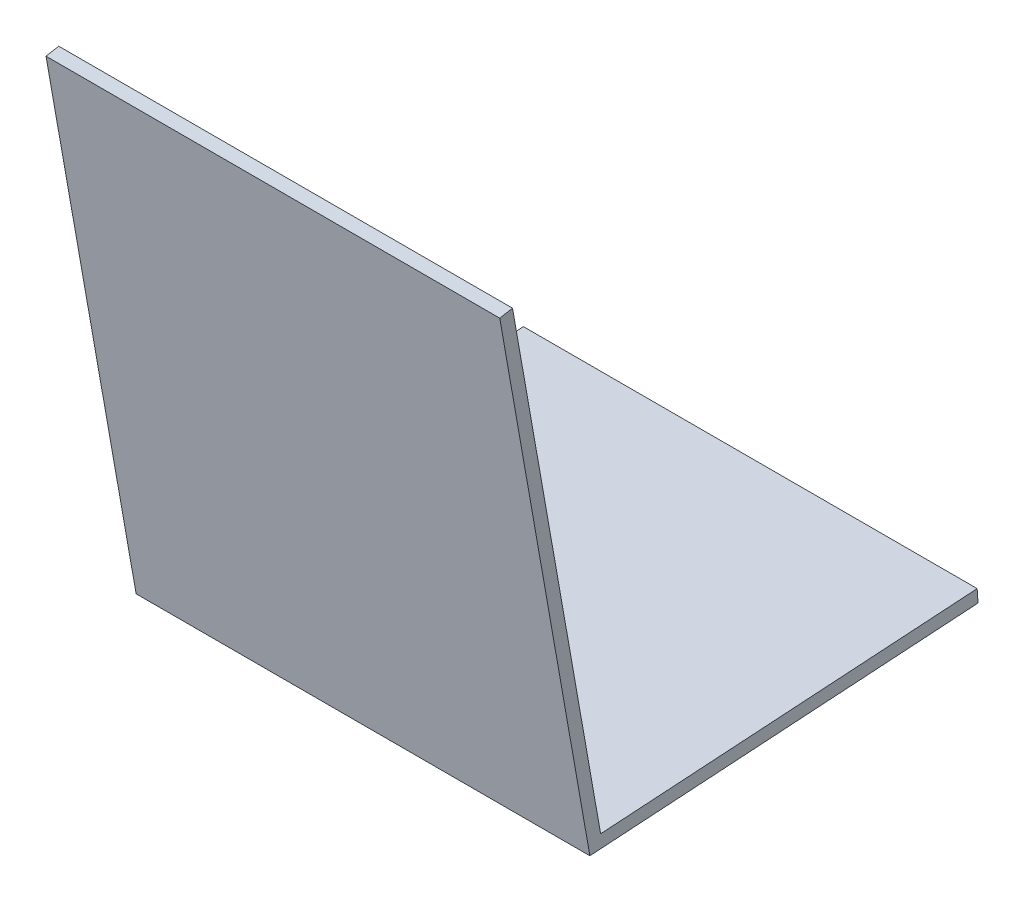
from build123d import *

# Parameters (mm, degrees)
BOSS_EXTRUDE1_DEPTH = 175


with BuildPart() as part:
    # Sketch1 → Boss-Extrude1 (new, symmetric)
    with BuildSketch(Plane(origin=(0, 0, 0), x_dir=(0, 0, -1), z_dir=(1, 0, 0))):
        Polygon((-923.912107867, 406.613423527), (-854.397974303, 12.7), (-555.009099907, 31.839014802), (-555.647067067, 41.818643948), (-846.10531811, 23.250536576), (-914.064272279, 408.351276866), align=None)
    extrude(amount=BOSS_EXTRUDE1_DEPTH, both=True)


solid = part.part
